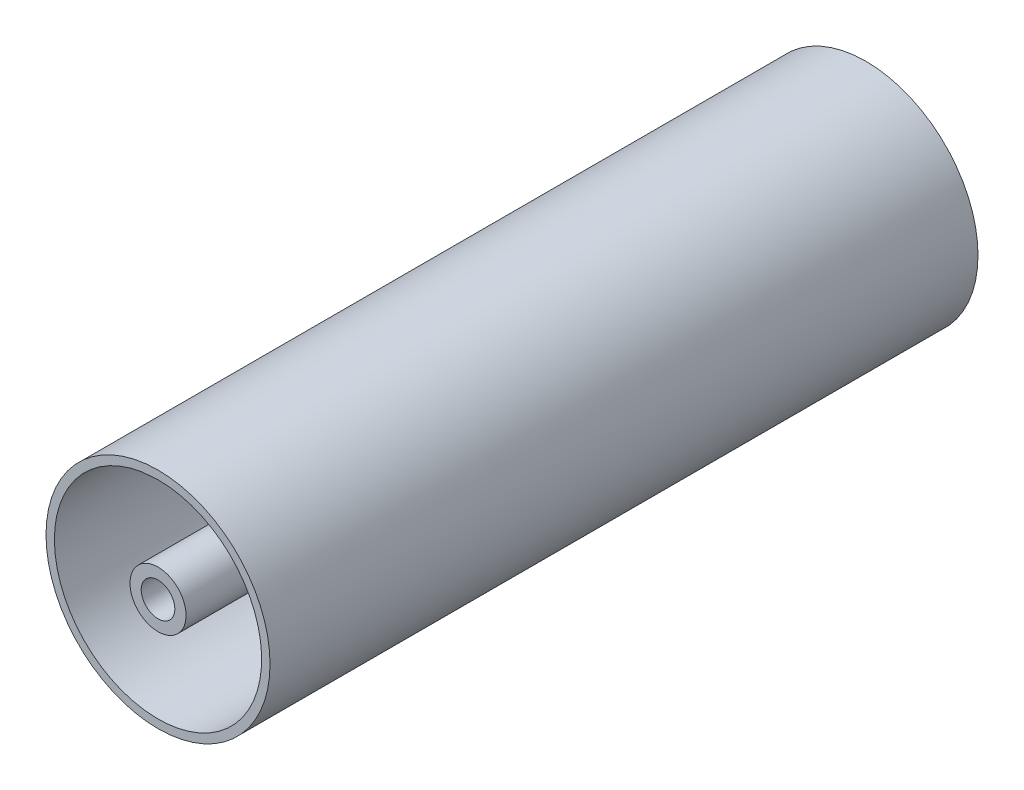
from build123d import *

# Parameters (mm, degrees)
SKETCH_2_R          = 20
SKETCH_2_R_2        = 18.5
EXTRUDE_1_DEPTH     = 126.4
SKETCH_5_R          = 3
EXTRUDE_3_DEPTH     = 126.4
CUT_EXTRUDE1_DEPTH  = 59
CUT_EXTRUDE2_DEPTH  = 59
SKETCH3_R           = 5
SKETCH3_R_2         = 3
BOSS_EXTRUDE1_DEPTH = 58.6


with BuildPart() as part:
    # Эскиз2 → Бобышка-Вытянуть1 (new body)
    with BuildSketch(Plane.XY):
        Circle(SKETCH_2_R)
        Circle(SKETCH_2_R_2, mode=Mode.SUBTRACT)
    extrude(amount=EXTRUDE_1_DEPTH)

    # Эскиз5 → Бобышка-Вытянуть3 (add, through all)
    with BuildSketch(Plane(origin=(0, 0, 0), x_dir=(-1, 0, 0), z_dir=(0, 0, -1))):
        with BuildLine():
            Line((0, 18.5), (0, 9.219544457))
            ThreePointArc((0, 9.219544457), (-0.725705562, 6.35915669), (-2.727272727, 4.190702026))
            ThreePointArc((-2.727272727, 4.190702026), (-0.405405405, -4.983537544), (3.368749585, 3.694797184))
            ThreePointArc((3.368749585, 3.694797184), (1.743983113, 6.158250179), (1.490138787, 9.098323274))
            Line((1.490138787, 9.098323274), (2.990122527, 18.256756757))
            ThreePointArc((2.990122527, 18.256756757), (1.5, 18.439088915), (0, 18.5))
        make_face()
        Circle(SKETCH_5_R, mode=Mode.SUBTRACT)
    extrude(amount=-EXTRUDE_3_DEPTH)

    # Sketch1 → Cut-Extrude1 (cut)
    with BuildSketch(Plane(origin=(0, 0, 0), x_dir=(-1, 0, 0), z_dir=(0, 0, -1))):
        with BuildLine():
            Line((0, 18.5), (2.990122527, 18.256756757))
            ThreePointArc((2.990122527, 18.256756757), (-1.5, -18.439088915), (0, 18.5))
        make_face()
    extrude(amount=-CUT_EXTRUDE1_DEPTH, mode=Mode.SUBTRACT)

    # Sketch2 → Cut-Extrude2 (cut)
    with BuildSketch(Plane.XY.offset(126.4)):
        with BuildLine():
            Line((0, 18.5), (-2.990122527, 18.256756757))
            ThreePointArc((-2.990122527, 18.256756757), (1.50000041, -18.439093959), (0, 18.5))
        make_face()
    extrude(amount=-CUT_EXTRUDE2_DEPTH, mode=Mode.SUBTRACT)


with BuildPart() as body_2:
    # Sketch3 → Boss-Extrude1 (new body)
    with BuildSketch(Plane.XY.offset(126.4)):
        Circle(SKETCH3_R)
        Circle(SKETCH3_R_2, mode=Mode.SUBTRACT)
    extrude(amount=-BOSS_EXTRUDE1_DEPTH)


solid = Compound([part.part, body_2.part])
